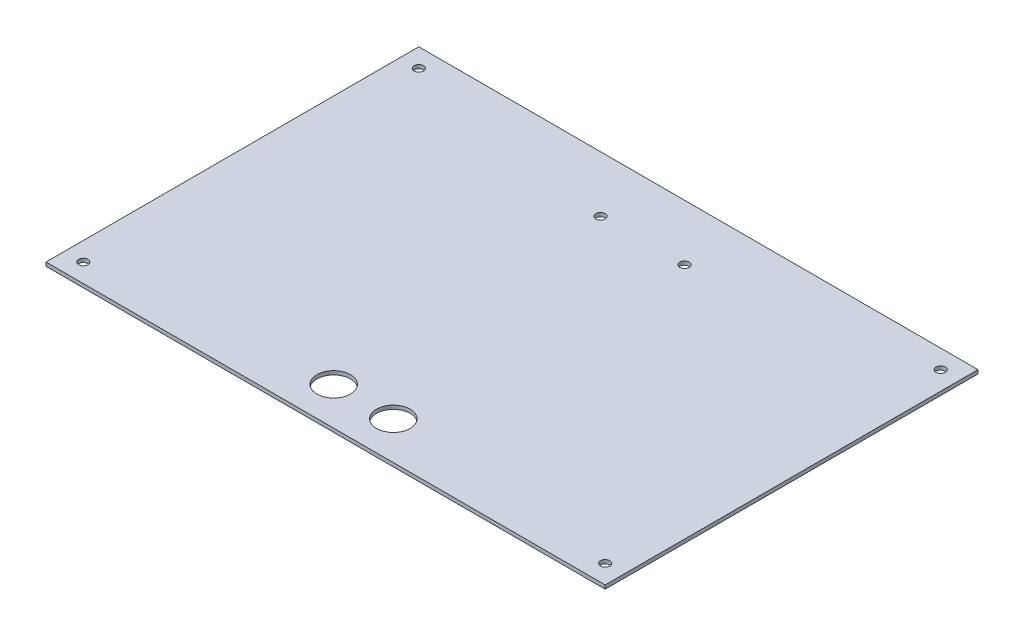
from build123d import *

# Parameters (mm, degrees)
ESBO_O1_W                = 300
ESBO_O1_H                = 200
ESBO_O1_R                = 2.5
ESBO_O1_R_2              = 9
RESSALTO_EXTRUS_O2_DEPTH = 2


with BuildPart() as part:
    # Esboço1 → Ressalto-extrusão2 (new body)
    with BuildSketch(Plane(origin=(0, 0, 0), x_dir=(1, 0, 0), z_dir=(0, 1, 0))):
        with Locations((85.905203177, -74.962969991)):
            Rectangle(ESBO_O1_W, ESBO_O1_H)
        with Locations(Location((-54.094796823, 15.037030009, 0), (0, 0, 270))):
            Circle(ESBO_O1_R, mode=Mode.SUBTRACT)
        with Locations(Location((225.905203177, 15.037030009, 0), (0, 0, 270))):
            Circle(ESBO_O1_R, mode=Mode.SUBTRACT)
        with Locations(Location((225.905203177, -164.962969991, 0), (0, 0, 270))):
            Circle(ESBO_O1_R, mode=Mode.SUBTRACT)
        with Locations(Location((-54.094796823, -164.962969991, 0), (0, 0, 270))):
            Circle(ESBO_O1_R, mode=Mode.SUBTRACT)
        with Locations(Location((63.405203177, -4.962969991, 0), (0, 0, 270))):
            Circle(ESBO_O1_R, mode=Mode.SUBTRACT)
        with Locations(Location((108.405203177, -4.962969991, 0), (0, 0, 270))):
            Circle(ESBO_O1_R, mode=Mode.SUBTRACT)
        with Locations(Location((101.905203177, -154.618414768, 0), (0, 0, 270))):
            Circle(ESBO_O1_R_2, mode=Mode.SUBTRACT)
        with Locations(Location((69.905203177, -154.618414768, 0), (0, 0, 270))):
            Circle(ESBO_O1_R_2, mode=Mode.SUBTRACT)
    extrude(amount=RESSALTO_EXTRUS_O2_DEPTH)


solid = part.part
